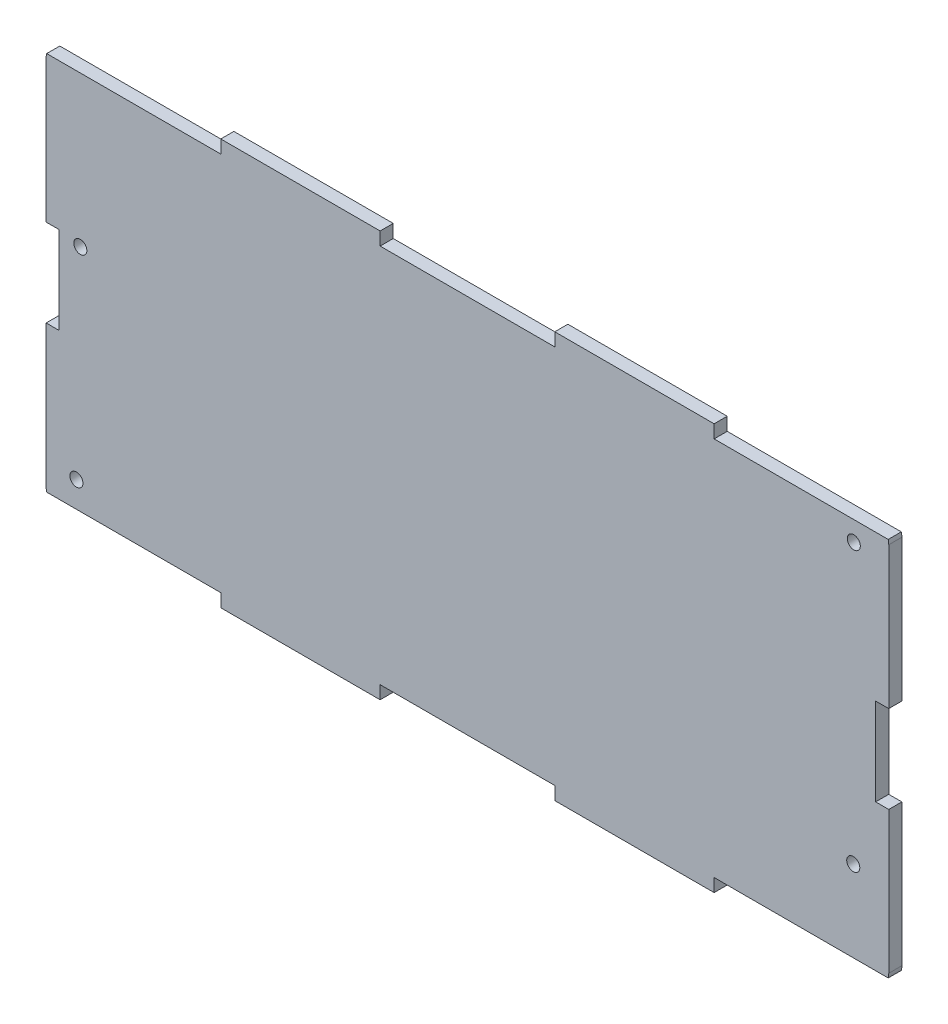
from build123d import *

# Parameters (mm, degrees)
BOSS_EXTRUDE2_DEPTH = 3
SKETCH3_R           = 1.5
SKETCH3_W           = 3
SKETCH3_H           = 20
SKETCH3_W_2         = 40
SKETCH3_H_2         = 3
CUT_EXTRUDE1_DEPTH  = 3


with BuildPart() as part:
    # Sketch1 → Boss-Extrude2 (new body)
    with BuildSketch(Plane.XY):
        with BuildLine():
            Line((-92.5, 46.5), (92.5, 46.5))
            ThreePointArc((92.5, 46.5), (95.328427125, 45.328427125), (96.5, 42.5))
            Line((96.5, 42.5), (96.5, -42.5))
            ThreePointArc((96.5, -42.5), (95.328427125, -45.328427125), (92.5, -46.5))
            Line((92.5, -46.5), (-92.5, -46.5))
            ThreePointArc((-92.5, -46.5), (-95.328427125, -45.328427125), (-96.5, -42.5))
            Line((-96.5, -42.5), (-96.5, 42.5))
            ThreePointArc((-96.5, 42.5), (-95.328427125, 45.328427125), (-92.5, 46.5))
        make_face()
    extrude(amount=BOSS_EXTRUDE2_DEPTH)

    # Sketch3 → Cut-Extrude1 (cut)
    with BuildSketch(Plane.XY.offset(3)):
        with Locations((-88.674, 9.010523044)):
            Circle(SKETCH3_R)
        with Locations((-89.563, -37.598476956)):
            Circle(SKETCH3_R)
        with Locations((88.364, -24.898476956)):
            Circle(SKETCH3_R)
        with Locations((88.491, 38.982523044)):
            Circle(SKETCH3_R)
        with Locations((-95, 0)):
            Rectangle(SKETCH3_W, SKETCH3_H)
        with Locations((95, 0)):
            Rectangle(SKETCH3_W, SKETCH3_H)
        with Locations((76.5, 45)):
            Rectangle(SKETCH3_W_2, SKETCH3_H_2)
        with Locations((-76.5, 45)):
            Rectangle(SKETCH3_W_2, SKETCH3_H_2)
        with Locations((76.5, -45)):
            Rectangle(SKETCH3_W_2, SKETCH3_H_2)
        with Locations((0, 45)):
            Rectangle(SKETCH3_W_2, SKETCH3_H_2)
        with Locations((0, -45)):
            Rectangle(SKETCH3_W_2, SKETCH3_H_2)
        with Locations((-76.5, -45)):
            Rectangle(SKETCH3_W_2, SKETCH3_H_2)
    extrude(amount=-CUT_EXTRUDE1_DEPTH, mode=Mode.SUBTRACT)


solid = part.part
